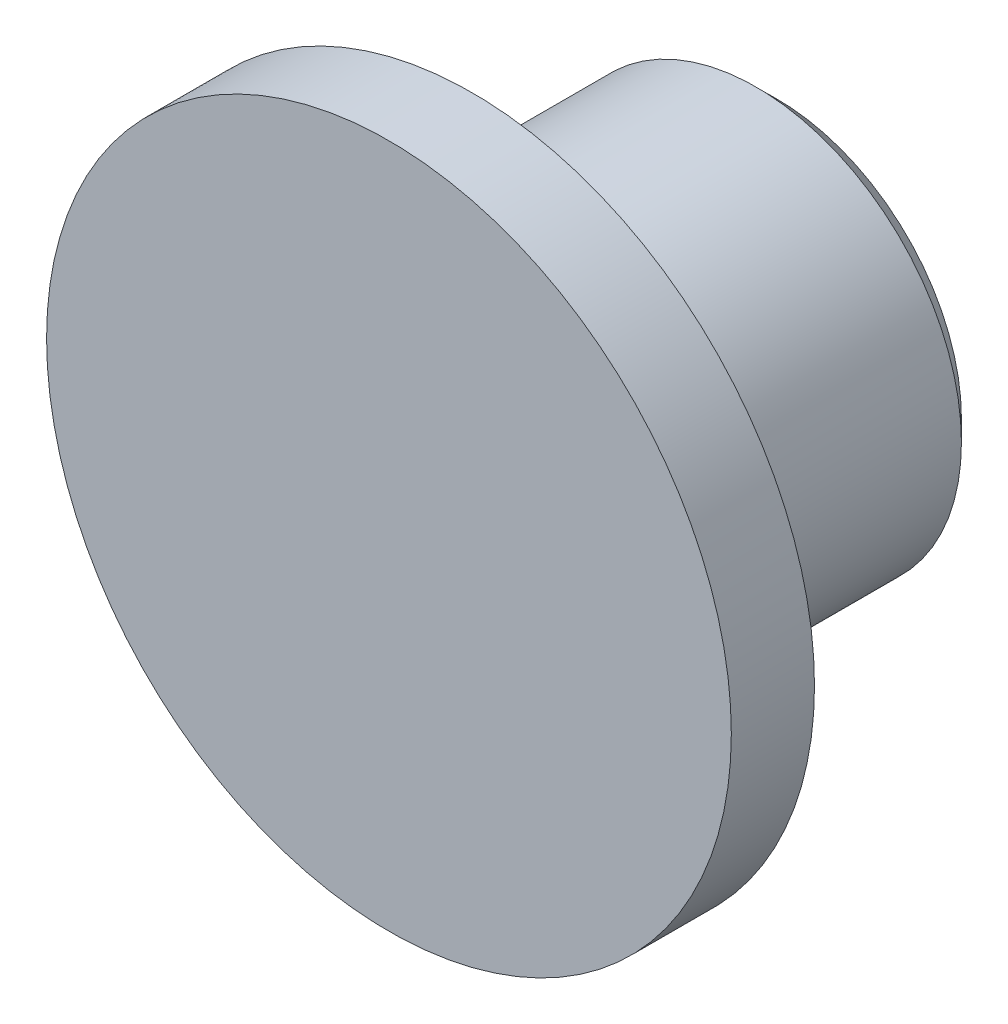
from build123d import *

# Parameters (mm, degrees)
SKETCH_1_R      = 2.47
EXTRUDE_1_DEPTH = 0.6
SKETCH_2_R      = 1.48
EXTRUDE_2_DEPTH = 2.2
CHAMFER_1_SIZE  = 0.15


with BuildPart() as part:
    # 草图1 → 凸台-拉伸1 (new body)
    with BuildSketch(Plane.XY.offset(-54.8040151)):
        with Locations(Location((-14.853491423, -1.524148547, 0), (0, 0, 180))):
            Circle(SKETCH_1_R)
    extrude(amount=EXTRUDE_1_DEPTH)

    # 草图2 → 凸台-拉伸2 (add)
    with BuildSketch(Plane.XY.offset(-54.8040151)):
        with Locations((-14.853491423, -1.524148547)):
            Circle(SKETCH_2_R)
    extrude(amount=-EXTRUDE_2_DEPTH)

    # 倒角1
    chamfer_1_edges = [part.edges().sort_by_distance(p)[0] for p in [
        (-16.333491423, -1.524148547, -57.0040151),
    ]]
    chamfer(chamfer_1_edges, length=CHAMFER_1_SIZE)


solid = part.part
